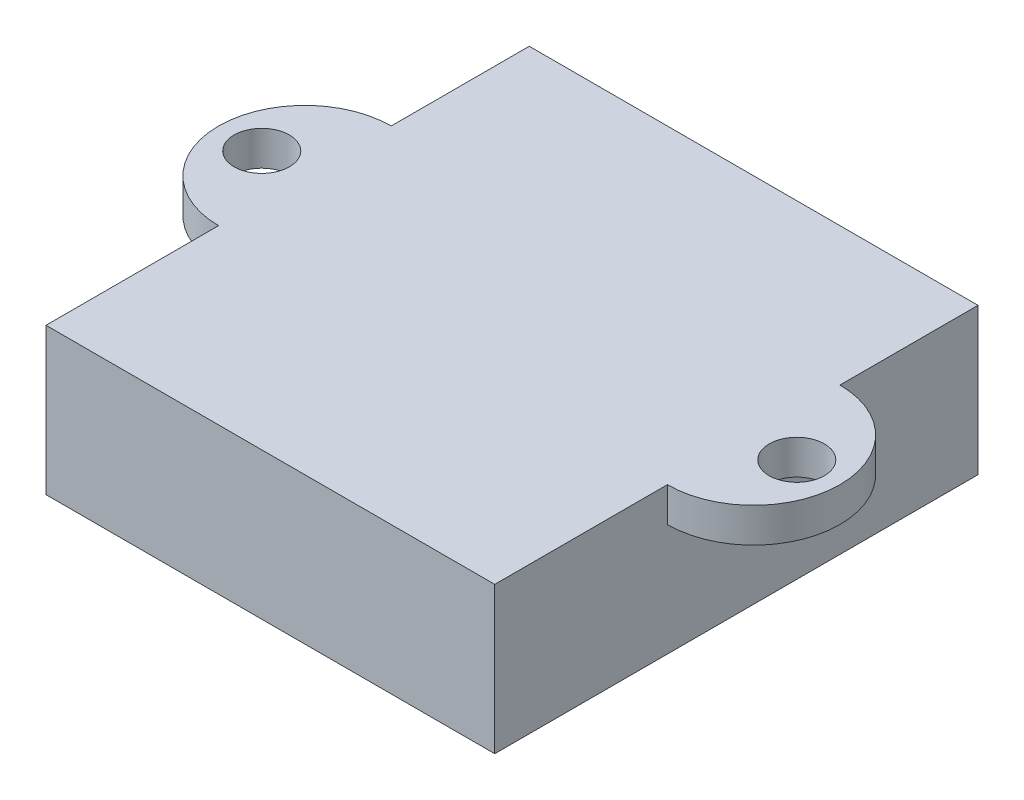
from build123d import *

# Parameters (mm, degrees)
SKETCH1_W            = 26
SKETCH1_H            = 28
BOSS_EXTRUDE1_DEPTH  = 8.5
SKETCH2_R            = 5
BOSS_EXTRUDE2_DEPTH  = 2
M3_CLEARANCE_HOLE1_D = 3.2


with BuildPart() as part:
    # Sketch1 → Boss-Extrude1 (new body)
    with BuildSketch(Plane(origin=(0, 0, 0), x_dir=(1, 0, 0), z_dir=(0, 1, 0))):
        Rectangle(SKETCH1_W, SKETCH1_H)
    extrude(amount=BOSS_EXTRUDE1_DEPTH)

    # Sketch2 → Boss-Extrude2 (add)
    with BuildSketch(Plane(origin=(0, 8.5, 0), x_dir=(1, 0, 0), z_dir=(0, 1, 0))):
        with Locations((-13, 1)):
            Circle(SKETCH2_R)
        with Locations((13, 1)):
            Circle(SKETCH2_R)
    extrude(amount=-BOSS_EXTRUDE2_DEPTH)

    # M3 Clearance Hole1 (through all)
    with Locations(Plane(origin=(0, 8.5, 0), x_dir=(1, 0, 0), z_dir=(0, 1, 0))):
        with Locations((-15.5, 1), (15.5, 1)):
            Hole(M3_CLEARANCE_HOLE1_D / 2)


solid = part.part
